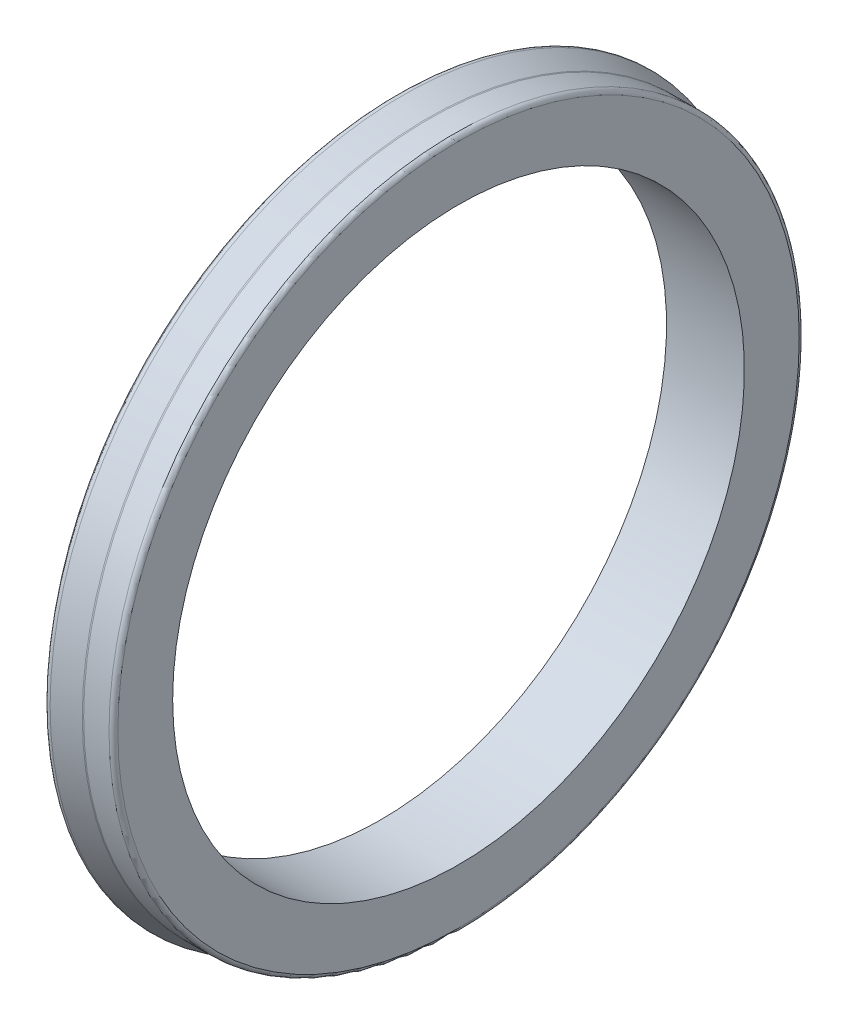
from build123d import *


with BuildPart() as part:
    # Croquis1 → Revolución1 (revolve)
    with BuildSketch(Plane(origin=(0, 0, 0), x_dir=(1, 0, 0), z_dir=(0, 1, 0)), mode=Mode.PRIVATE) as revoluci_n1_sk:
        with BuildLine():
            Line((-6.298995486, 12.950809067), (-2.772005084, 12.950809067))
            Line((-2.772005084, 12.950809067), (-2.772005084, 15.434870945))
            ThreePointArc((-2.772005084, 15.434870945), (-2.830583728, 15.576292301), (-2.972005084, 15.634870945))
            Line((-2.972005084, 15.634870945), (-4.119479121, 15.634870945))
            ThreePointArc((-4.119479121, 15.634870945), (-4.147043925, 15.636779598), (-4.174082612, 15.642469129))
            Line((-4.174082612, 15.642469129), (-5.309187131, 15.964610942))
            ThreePointArc((-5.309187131, 15.964610942), (-5.42261125, 15.963363864), (-5.517114853, 15.900629065))
            Line((-5.517114853, 15.900629065), (-5.758097556, 15.612912936))
            ThreePointArc((-5.758097556, 15.612912936), (-5.797568014, 15.431293296), (-5.670542855, 15.2956164))
            Line((-5.670542855, 15.2956164), (-4.214967049, 14.788764111))
            ThreePointArc((-4.214967049, 14.788764111), (-4.081546808, 14.581903203), (-4.249861202, 14.402285107))
            Line((-4.249861202, 14.402285107), (-6.129870862, 14.108533597))
            ThreePointArc((-6.129870862, 14.108533597), (-6.250941324, 14.040979114), (-6.298995486, 13.910931191))
            Line((-6.298995486, 13.910931191), (-6.298995486, 12.950809067))
        make_face()
    revolve(revoluci_n1_sk.sketch.rotate(Axis((0, 0, 0), (1, 0, 0)), 180), axis=Axis((0, 0, 0), (1, 0, 0)))


solid = part.part
